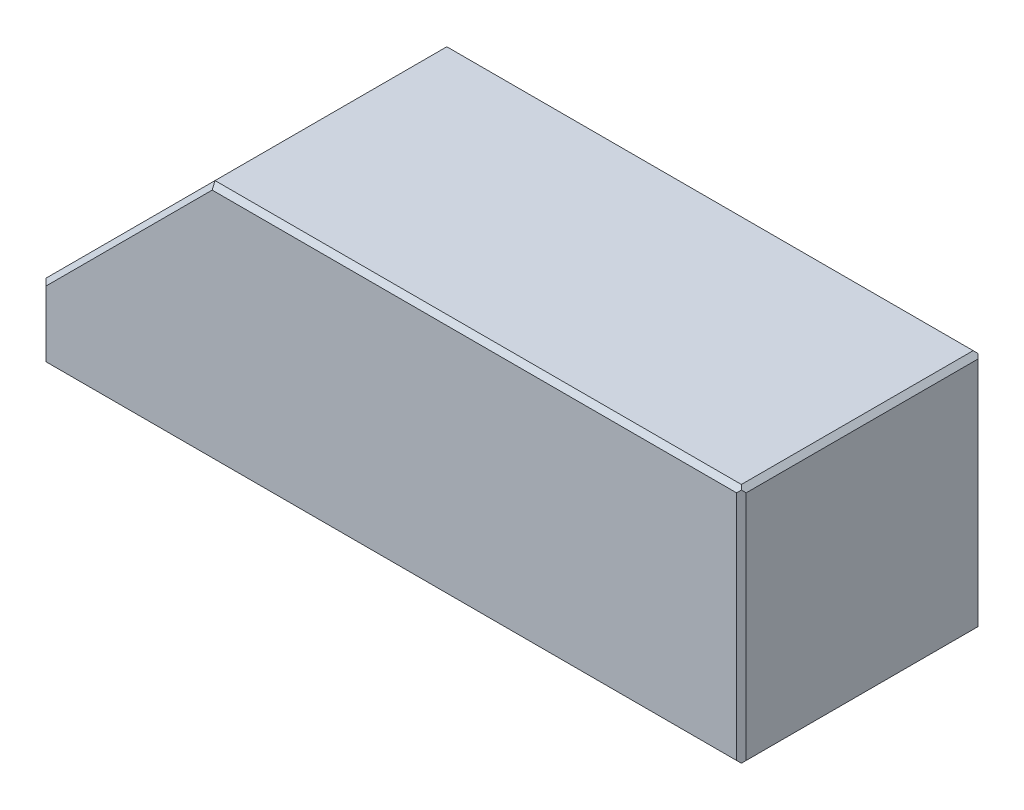
from build123d import *

# Parameters (mm, degrees)
SKETCH1_W                      = 145
SKETCH1_H                      = 50
BOSS_EXTRUDE1_DEPTH            = 25
CUT_EXTRUDE1_DEPTH             = 81.661329025
CUT_EXTRUDE1_DEPTH_BACK        = 81.661329025
F_12_0_12_DIAMETER_HOLE1_D     = 12
F_12_0_12_DIAMETER_HOLE1_DEPTH = 18
M10_TAPPED_HOLE2_D             = 8.5
M10_TAPPED_HOLE2_DEPTH         = 24.946342369
M10_TAPPED_HOLE2_TIP           = 2.553657631
CHAMFER1_SIZE                  = 1
CHAMFER2_SIZE                  = 1
CHAMFER3_SIZE                  = 1


with BuildPart() as part:
    # Sketch1 → Boss-Extrude1 (new, symmetric)
    with BuildSketch(Plane.XY):
        Rectangle(SKETCH1_W, SKETCH1_H)
    extrude(amount=BOSS_EXTRUDE1_DEPTH, both=True)

    # Sketch2 → Cut-Extrude1 (cut, two sides: drawn at the far end of the back side and taken through both)
    with BuildSketch(Plane.XY.offset(-CUT_EXTRUDE1_DEPTH_BACK)):
        Polygon((-72.5, -10), (-37.5, 25), (-72.5, 25), align=None)
    extrude(amount=CUT_EXTRUDE1_DEPTH + CUT_EXTRUDE1_DEPTH_BACK, mode=Mode.SUBTRACT)

    # Ø12.0 (12) Diameter Hole1
    with Locations(Plane.ZY.offset(72.5)):
        with Locations((0, -5)):
            Hole(F_12_0_12_DIAMETER_HOLE1_D / 2, depth=F_12_0_12_DIAMETER_HOLE1_DEPTH)

    # M10 Tapped Hole2
    with Locations(Plane.ZY.offset(54.5)):
        with Locations((0, -5)):
            Hole(M10_TAPPED_HOLE2_D / 2, depth=M10_TAPPED_HOLE2_DEPTH)
            with Locations((0, 0, -(M10_TAPPED_HOLE2_DEPTH + M10_TAPPED_HOLE2_TIP / 2))):  # 118° drill point
                Cone(0, M10_TAPPED_HOLE2_D / 2, M10_TAPPED_HOLE2_TIP, mode=Mode.SUBTRACT)

    # Chamfer1
    chamfer1_edges = [part.edges().sort_by_distance(p)[0] for p in [
        (-72.5, -17.5, -25),
        (-72.5, -17.5, 25),
        (0, -25, 25),
        (-55, 7.5, -25),
        (-55, 7.5, 25),
        (72.5, 0, 25),
        (0, -25, -25),
        (17.5, 25, -25),
        (72.5, 0, -25),
        (17.5, 25, 25),
    ]]
    chamfer(chamfer1_edges, length=CHAMFER1_SIZE)

    # Chamfer2
    chamfer2_edges = [part.edges().sort_by_distance(p)[0] for p in [
        (72.5, -25, 0),
        (72.5, 25, 0),
    ]]
    chamfer(chamfer2_edges, length=CHAMFER2_SIZE)

    # Chamfer3
    chamfer3_edges = [part.edges().sort_by_distance(p)[0] for p in [
        (-72.5, -25, 0),
    ]]
    chamfer(chamfer3_edges, length=CHAMFER3_SIZE)


solid = part.part
